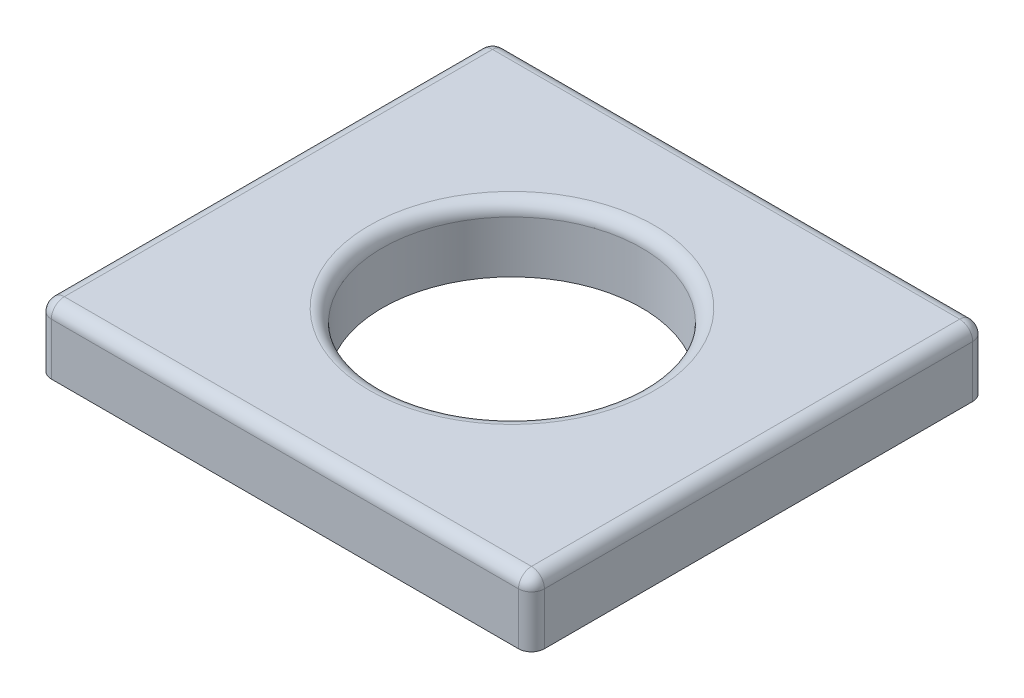
from build123d import *

# Parameters (mm, degrees)
SKETCH1_W           = 7.6
SKETCH1_H           = 7
BOSS_EXTRUDE1_DEPTH = 1
SKETCH2_R           = 2
CUT_EXTRUDE1_DEPTH  = 6.262128847
FILLET1_R           = 0.2


with BuildPart() as part:
    # Sketch1 → Boss-Extrude1 (new body)
    with BuildSketch(Plane(origin=(0, 0, 0), x_dir=(1, 0, 0), z_dir=(0, 1, 0))):
        Rectangle(SKETCH1_W, SKETCH1_H)
    extrude(amount=BOSS_EXTRUDE1_DEPTH)

    # Sketch2 → Cut-Extrude1 (cut, through all)
    with BuildSketch(Plane(origin=(0, 1, 0), x_dir=(1, 0, 0), z_dir=(0, 1, 0))):
        with Locations(Location((0, 0, 0), (0, 0, 270))):
            Circle(SKETCH2_R)
    extrude(amount=-CUT_EXTRUDE1_DEPTH, mode=Mode.SUBTRACT)

    # Fillet1
    fillet1_edges = [part.edges().sort_by_distance(p)[0] for p in [
        (-3.8, 1, 0),
        (0, 1, -2),
        (0, 1, 3.5),
        (3.8, 1, 0),
        (3.8, 0.5, 3.5),
        (-3.8, 0.5, 3.5),
        (-3.8, 0.5, -3.5),
        (3.8, 0.5, -3.5),
        (0, 1, -3.5),
    ]]
    fillet(fillet1_edges, radius=FILLET1_R)


solid = part.part
